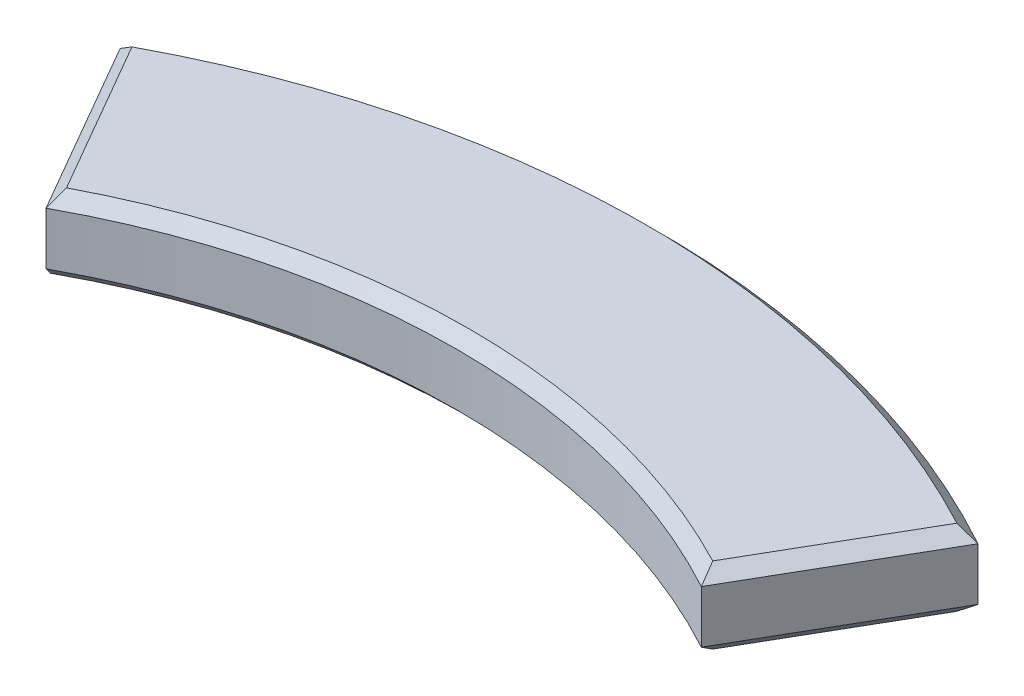
from build123d import *

# Parameters (mm, degrees)
BOSS_EXTRUDE1_DEPTH = 3.2
CHAMFER1_SIZE       = 0.5
SKETCH2_R           = 1.625
CUT_EXTRUDE1_DEPTH  = 2


with BuildPart() as part:
    # Sketch1 → Boss-Extrude1 (new body)
    with BuildSketch(Plane(origin=(0, 0, 0), x_dir=(1, 0, 0), z_dir=(0, 1, 0))):
        with BuildLine():
            Line((-17.971705397, 32.627906846), (-13.729256498, 25.279769804))
            ThreePointArc((-13.729256498, 25.279769804), (0, 28.767329478), (13.729256498, 25.279769804))
            Line((13.729256498, 25.279769804), (17.971705397, 32.627906846))
            ThreePointArc((17.971705397, 32.627906846), (0, 37.25), (-17.971705397, 32.627906846))
        make_face()
    extrude(amount=BOSS_EXTRUDE1_DEPTH)

    # Chamfer1
    chamfer1_edges = [part.edges().sort_by_distance(p)[0] for p in [
        (0, 3.2, -28.767329478),
        (15.850480947, 3.2, -28.953838325),
        (0, 3.2, -37.25),
        (15.850480947, 0, -28.953838325),
        (0, 0, -28.767329478),
        (0, 0, -37.25),
        (-15.850480947, 3.2, -28.953838325),
    ]]
    chamfer(chamfer1_edges, length=CHAMFER1_SIZE)

    # Sketch2 → Cut-Extrude1 (cut)
    with BuildSketch(Plane.XZ):
        with Locations(Location((0, -33, 0), (0, 0, 270))):
            Circle(SKETCH2_R)
    extrude(amount=-CUT_EXTRUDE1_DEPTH, mode=Mode.SUBTRACT)


solid = part.part
